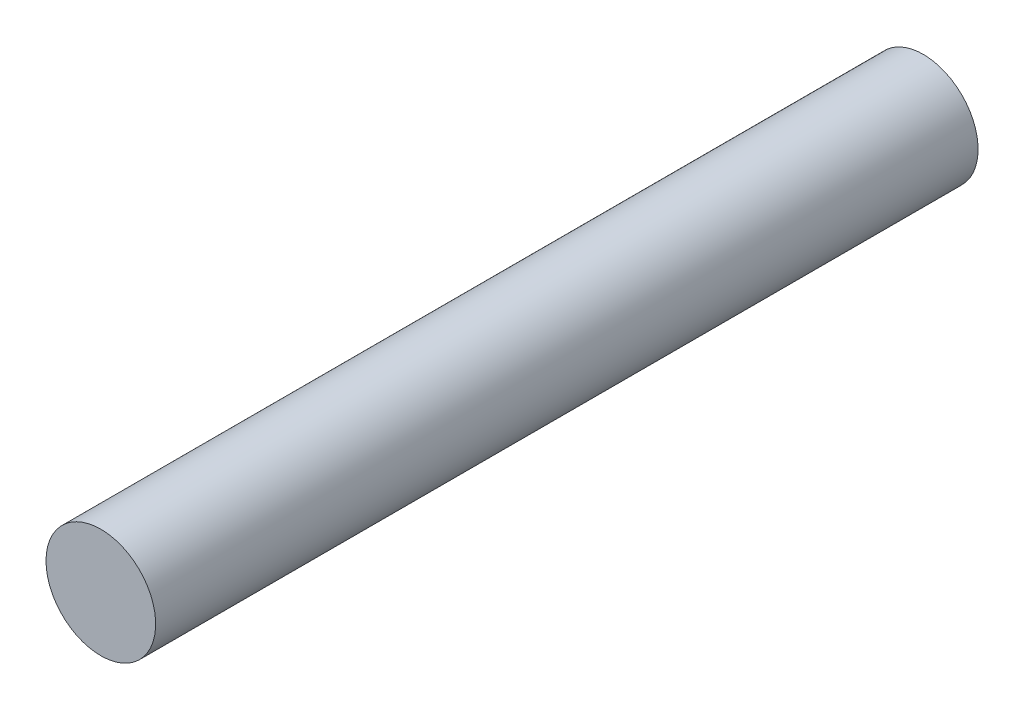
from build123d import *

# Parameters (mm, degrees)
SKETCH2_R           = 6
BOSS_EXTRUDE1_DEPTH = 90


with BuildPart() as part:
    # Sketch2 → Boss-Extrude1 (new body)
    with BuildSketch(Plane.XY):
        with Locations(Location((0, 0, 0), (0, 0, 180))):
            Circle(SKETCH2_R)
    extrude(amount=BOSS_EXTRUDE1_DEPTH)


solid = part.part
